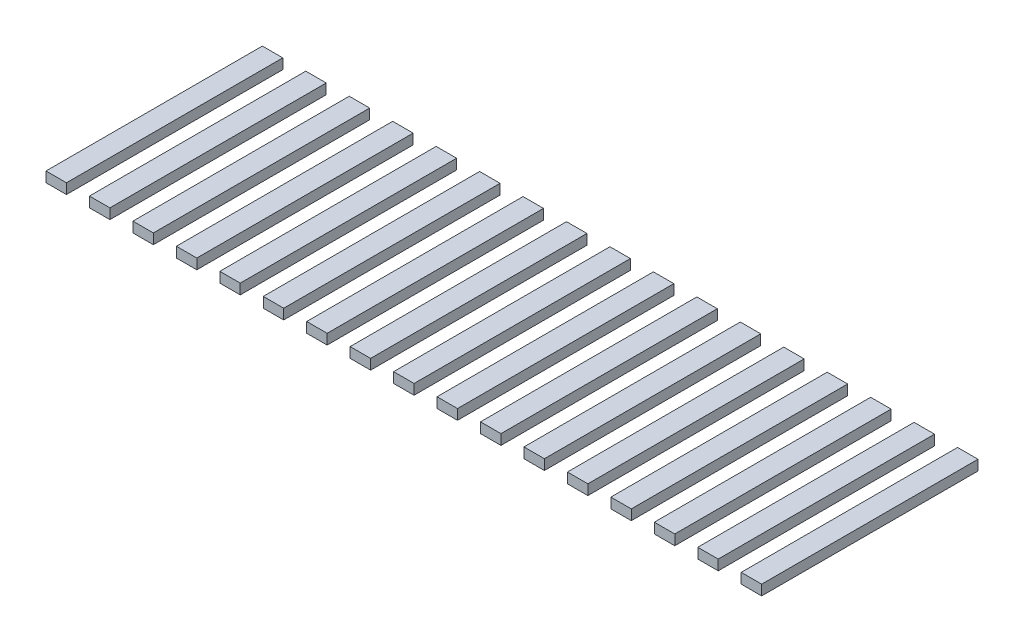
from build123d import *

# Parameters (mm, degrees)
SKETCH1_W              = 0.4
SKETCH1_H              = 4.232283465
BOSS_EXTRUDE1_DEPTH    = 0.2
BOSS_EXTRUDE1_2_DEPTH  = 0.2
BOSS_EXTRUDE1_3_DEPTH  = 0.2
BOSS_EXTRUDE1_4_DEPTH  = 0.2
BOSS_EXTRUDE1_5_DEPTH  = 0.2
BOSS_EXTRUDE1_6_DEPTH  = 0.2
BOSS_EXTRUDE1_7_DEPTH  = 0.2
BOSS_EXTRUDE1_8_DEPTH  = 0.2
BOSS_EXTRUDE1_9_DEPTH  = 0.2
BOSS_EXTRUDE1_10_DEPTH = 0.2
BOSS_EXTRUDE1_11_DEPTH = 0.2
BOSS_EXTRUDE1_12_DEPTH = 0.2
BOSS_EXTRUDE1_13_DEPTH = 0.2
BOSS_EXTRUDE1_14_DEPTH = 0.2
BOSS_EXTRUDE1_15_DEPTH = 0.2
BOSS_EXTRUDE1_16_DEPTH = 0.2
BOSS_EXTRUDE1_17_DEPTH = 0.2


with BuildPart() as part:
    # Sketch1 → Boss-Extrude1 (new body)
    with BuildSketch(Plane(origin=(0, 0, 0), x_dir=(1, 0, 0), z_dir=(0, 1, 0))):
        with Locations((-49.781526204, -17.035592861)):
            Rectangle(SKETCH1_W, SKETCH1_H)
    extrude(amount=BOSS_EXTRUDE1_DEPTH)


with BuildPart() as body_2:
    # Sketch1 → Boss-Extrude1 2 (new body)
    with BuildSketch(Plane(origin=(0, 0, 0), x_dir=(1, 0, 0), z_dir=(0, 1, 0))):
        with Locations((-50.631526204, -17.035592861)):
            Rectangle(SKETCH1_W, SKETCH1_H)
    extrude(amount=BOSS_EXTRUDE1_2_DEPTH)


with BuildPart() as body_3:
    # Sketch1 → Boss-Extrude1 3 (new body)
    with BuildSketch(Plane(origin=(0, 0, 0), x_dir=(1, 0, 0), z_dir=(0, 1, 0))):
        with Locations((-48.931526204, -17.035592861)):
            Rectangle(SKETCH1_W, SKETCH1_H)
    extrude(amount=BOSS_EXTRUDE1_3_DEPTH)


with BuildPart() as body_4:
    # Sketch1 → Boss-Extrude1 4 (new body)
    with BuildSketch(Plane(origin=(0, 0, 0), x_dir=(1, 0, 0), z_dir=(0, 1, 0))):
        with Locations((-48.081526204, -17.035592861)):
            Rectangle(SKETCH1_W, SKETCH1_H)
    extrude(amount=BOSS_EXTRUDE1_4_DEPTH)


with BuildPart() as body_5:
    # Sketch1 → Boss-Extrude1 5 (new body)
    with BuildSketch(Plane(origin=(0, 0, 0), x_dir=(1, 0, 0), z_dir=(0, 1, 0))):
        with Locations((-47.231526204, -17.035592861)):
            Rectangle(SKETCH1_W, SKETCH1_H)
    extrude(amount=BOSS_EXTRUDE1_5_DEPTH)


with BuildPart() as body_6:
    # Sketch1 → Boss-Extrude1 6 (new body)
    with BuildSketch(Plane(origin=(0, 0, 0), x_dir=(1, 0, 0), z_dir=(0, 1, 0))):
        with Locations((-46.381526204, -17.035592861)):
            Rectangle(SKETCH1_W, SKETCH1_H)
    extrude(amount=BOSS_EXTRUDE1_6_DEPTH)


with BuildPart() as body_7:
    # Sketch1 → Boss-Extrude1 7 (new body)
    with BuildSketch(Plane(origin=(0, 0, 0), x_dir=(1, 0, 0), z_dir=(0, 1, 0))):
        with Locations((-45.531526204, -17.035592861)):
            Rectangle(SKETCH1_W, SKETCH1_H)
    extrude(amount=BOSS_EXTRUDE1_7_DEPTH)


with BuildPart() as body_8:
    # Sketch1 → Boss-Extrude1 8 (new body)
    with BuildSketch(Plane(origin=(0, 0, 0), x_dir=(1, 0, 0), z_dir=(0, 1, 0))):
        with Locations((-44.681526204, -17.035592861)):
            Rectangle(SKETCH1_W, SKETCH1_H)
    extrude(amount=BOSS_EXTRUDE1_8_DEPTH)


with BuildPart() as body_9:
    # Sketch1 → Boss-Extrude1 9 (new body)
    with BuildSketch(Plane(origin=(0, 0, 0), x_dir=(1, 0, 0), z_dir=(0, 1, 0))):
        with Locations((-43.831526204, -17.035592861)):
            Rectangle(SKETCH1_W, SKETCH1_H)
    extrude(amount=BOSS_EXTRUDE1_9_DEPTH)


with BuildPart() as body_10:
    # Sketch1 → Boss-Extrude1 10 (new body)
    with BuildSketch(Plane(origin=(0, 0, 0), x_dir=(1, 0, 0), z_dir=(0, 1, 0))):
        with Locations((-42.981526204, -17.035592861)):
            Rectangle(SKETCH1_W, SKETCH1_H)
    extrude(amount=BOSS_EXTRUDE1_10_DEPTH)


with BuildPart() as body_11:
    # Sketch1 → Boss-Extrude1 11 (new body)
    with BuildSketch(Plane(origin=(0, 0, 0), x_dir=(1, 0, 0), z_dir=(0, 1, 0))):
        with Locations((-42.131526204, -17.035592861)):
            Rectangle(SKETCH1_W, SKETCH1_H)
    extrude(amount=BOSS_EXTRUDE1_11_DEPTH)


with BuildPart() as body_12:
    # Sketch1 → Boss-Extrude1 12 (new body)
    with BuildSketch(Plane(origin=(0, 0, 0), x_dir=(1, 0, 0), z_dir=(0, 1, 0))):
        with Locations((-41.281526204, -17.035592861)):
            Rectangle(SKETCH1_W, SKETCH1_H)
    extrude(amount=BOSS_EXTRUDE1_12_DEPTH)


with BuildPart() as body_13:
    # Sketch1 → Boss-Extrude1 13 (new body)
    with BuildSketch(Plane(origin=(0, 0, 0), x_dir=(1, 0, 0), z_dir=(0, 1, 0))):
        with Locations((-40.431526204, -17.035592861)):
            Rectangle(SKETCH1_W, SKETCH1_H)
    extrude(amount=BOSS_EXTRUDE1_13_DEPTH)


with BuildPart() as body_14:
    # Sketch1 → Boss-Extrude1 14 (new body)
    with BuildSketch(Plane(origin=(0, 0, 0), x_dir=(1, 0, 0), z_dir=(0, 1, 0))):
        with Locations((-39.581526204, -17.035592861)):
            Rectangle(SKETCH1_W, SKETCH1_H)
    extrude(amount=BOSS_EXTRUDE1_14_DEPTH)


with BuildPart() as body_15:
    # Sketch1 → Boss-Extrude1 15 (new body)
    with BuildSketch(Plane(origin=(0, 0, 0), x_dir=(1, 0, 0), z_dir=(0, 1, 0))):
        with Locations((-38.731526204, -17.035592861)):
            Rectangle(SKETCH1_W, SKETCH1_H)
    extrude(amount=BOSS_EXTRUDE1_15_DEPTH)


with BuildPart() as body_16:
    # Sketch1 → Boss-Extrude1 16 (new body)
    with BuildSketch(Plane(origin=(0, 0, 0), x_dir=(1, 0, 0), z_dir=(0, 1, 0))):
        with Locations((-37.881526204, -17.035592861)):
            Rectangle(SKETCH1_W, SKETCH1_H)
    extrude(amount=BOSS_EXTRUDE1_16_DEPTH)


with BuildPart() as body_17:
    # Sketch1 → Boss-Extrude1 17 (new body)
    with BuildSketch(Plane(origin=(0, 0, 0), x_dir=(1, 0, 0), z_dir=(0, 1, 0))):
        with Locations((-37.031526204, -17.035592861)):
            Rectangle(SKETCH1_W, SKETCH1_H)
    extrude(amount=BOSS_EXTRUDE1_17_DEPTH)


solid = Compound([part.part, body_2.part, body_3.part, body_4.part, body_5.part, body_6.part, body_7.part, body_8.part, body_9.part, body_10.part, body_11.part, body_12.part, body_13.part, body_14.part, body_15.part, body_16.part, body_17.part])
